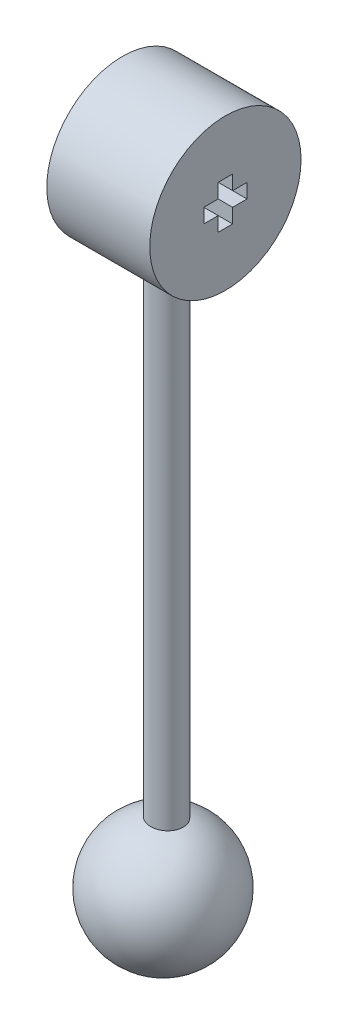
from build123d import *

# Parameters (mm, degrees)
SKETCH3_R           = 2.025729463
BOSS_EXTRUDE1_DEPTH = 74.168
BOSS_EXTRUDE5_START = -16.51
SKETCH4_R           = 9.333271044
BOSS_EXTRUDE5_DEPTH = 12.7


with BuildPart() as part:
    # Sketch1 → Revolve1 (revolve)
    with BuildSketch(Plane(origin=(0, 0, 0), x_dir=(1, 0, 0), z_dir=(0, 1, 0))):
        with BuildLine():
            Line((-16.919904062, 26.957438718), (-5.784386472, 15.821921128))
            ThreePointArc((-5.784386472, 15.821921128), (-5.784386472, 26.957438718), (-16.919904062, 26.957438718))
        make_face()
    revolve(axis=Axis((-16.919904062, 0, -26.957438718), (0.7071067811865476, 0, 0.7071067811865476)))

    # Sketch3 → Boss-Extrude1 (add)
    with BuildSketch(Plane(origin=(0, 0, 0), x_dir=(1, 0, 0), z_dir=(0, 1, 0))):
        with Locations(Location((-11.072249639, 21.554324411, 0), (0, 0, 134.105346527))):
            Circle(SKETCH3_R)
    extrude(amount=BOSS_EXTRUDE1_DEPTH)

    # Sketch4 → Boss-Extrude5 (add)
    with BuildSketch(Plane(origin=(0, 0, 0), x_dir=(0, 0, -1), z_dir=(1, 0, 0)).offset(BOSS_EXTRUDE5_START)):
        with Locations((21.554324411, 76.835)):
            Circle(SKETCH4_R)
        Polygon((22.443324411, 75.946), (22.443324411, 74.168), (20.665324411, 74.168), (20.665324411, 75.946), (18.887324411, 75.946), (18.887324411, 77.724), (20.665324411, 77.724), (20.665324411, 79.502), (22.443324411, 79.502), (22.443324411, 77.724), (24.221324411, 77.724), (24.221324411, 75.946), align=None, mode=Mode.SUBTRACT)
    extrude(amount=BOSS_EXTRUDE5_DEPTH)


solid = part.part
